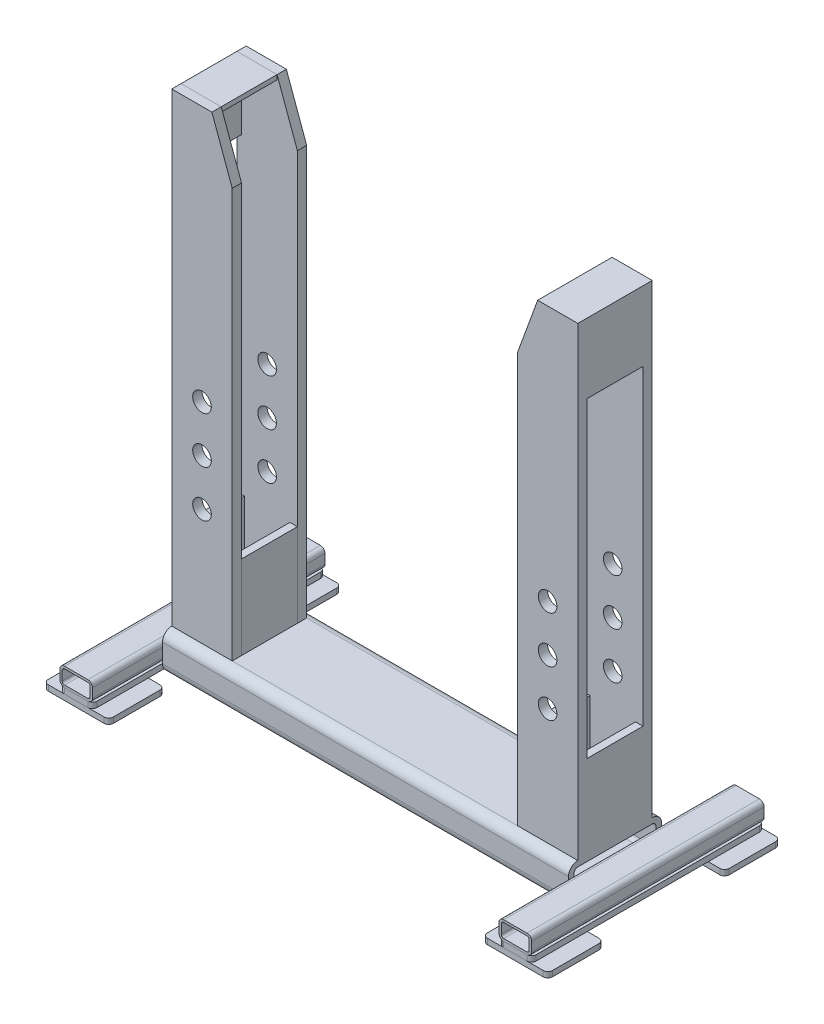
from build123d import *

# Parameters (mm, degrees)
BOSS_EXTRUDE1_DEPTH                    = 12
BOSS_EXTRUDE1_2_DEPTH                  = 12
RECTANGULAR_TUBE_70_X_40_X_5_1_DEPTH   = 500
RECTANGULAR_TUBE_70_X_40_X_5_1_2_DEPTH = 500
RECTANGULAR_TUBE_120_X_80_X_8_1_DEPTH  = 873
BOSS_EXTRUDE2_DEPTH                    = 12
BOSS_EXTRUDE2_2_DEPTH                  = 12
BOSS_EXTRUDE2_3_DEPTH                  = 12
BOSS_EXTRUDE2_4_DEPTH                  = 12
SKETCH18_W                             = 130
SKETCH18_H                             = 20
BOSS_EXTRUDE3_DEPTH                    = 1000
BOSS_EXTRUDE3_2_DEPTH                  = 1000
SKETCH19_W                             = 16
SKETCH19_H                             = 180
BOSS_EXTRUDE4_DEPTH                    = 120
BOSS_EXTRUDE4_2_DEPTH                  = 120
CUT_EXTRUDE1_DEPTH                     = 1200
SKETCH21_R                             = 20
CUT_EXTRUDE2_DEPTH                     = 1200
LPATTERN1_COUNT                        = 3
LPATTERN1_PITCH                        = 100
MIRROR2_COPY_1_SKETCH_R                = 20
MIRROR2_COPY_1_DEPTH                   = 1200
MIRROR2_COPY_2_SKETCH_R                = 20
MIRROR2_COPY_2_DEPTH                   = 1200
BOSS_EXTRUDE5_DEPTH                    = 120


with BuildPart() as part:
    # Sketch1 → Boss-Extrude1 (new body)
    with BuildSketch(Plane(origin=(0, 0, 0), x_dir=(1, 0, 0), z_dir=(0, 1, 0))):
        with BuildLine():
            Line((-497, -250), (-447, -250))
            ThreePointArc((-447, -250), (-439.928932188, -247.071067812), (-437, -240))
            Line((-437, -240), (-437, 240))
            ThreePointArc((-437, 240), (-439.928932188, 247.071067812), (-447, 250))
            Line((-447, 250), (-497, 250))
            ThreePointArc((-497, 250), (-504.071067812, 247.071067812), (-507, 240))
            Line((-507, 240), (-507, -240))
            ThreePointArc((-507, -240), (-504.071067812, -247.071067812), (-497, -250))
        make_face()
    extrude(amount=BOSS_EXTRUDE1_DEPTH)


with BuildPart() as body_2:
    # Sketch1 → Boss-Extrude1 2 (new body)
    with BuildSketch(Plane(origin=(0, 0, 0), x_dir=(1, 0, 0), z_dir=(0, 1, 0))):
        with BuildLine():
            Line((447, -250), (497, -250))
            ThreePointArc((497, -250), (504.071067812, -247.071067812), (507, -240))
            Line((507, -240), (507, 240))
            ThreePointArc((507, 240), (504.071067812, 247.071067812), (497, 250))
            Line((497, 250), (447, 250))
            ThreePointArc((447, 250), (439.928932188, 247.071067812), (437, 240))
            Line((437, 240), (437, -240))
            ThreePointArc((437, -240), (439.928932188, -247.071067812), (447, -250))
        make_face()
    extrude(amount=BOSS_EXTRUDE1_2_DEPTH)


with BuildPart() as body_3:
    # Sketch11 → Rectangular tube 70 X 40 X 5(1) (new body)
    with BuildSketch(Plane(origin=(472, 32, 250), x_dir=(0, 1, 0), z_dir=(0, 0, -1))):
        with BuildLine():
            Line((-10, -35), (10, -35))
            ThreePointArc((10, -35), (17.071067812, -32.071067812), (20, -25))
            Line((20, -25), (20, 25))
            ThreePointArc((20, 25), (17.071067812, 32.071067812), (10, 35))
            Line((10, 35), (-10, 35))
            ThreePointArc((-10, 35), (-17.071067812, 32.071067812), (-20, 25))
            Line((-20, 25), (-20, -25))
            ThreePointArc((-20, -25), (-17.071067812, -32.071067812), (-10, -35))
        make_face()
        with BuildLine():
            Line((-10, -30), (10, -30))
            ThreePointArc((10, -30), (13.535533906, -28.535533906), (15, -25))
            Line((15, -25), (15, 25))
            ThreePointArc((15, 25), (13.535533906, 28.535533906), (10, 30))
            Line((10, 30), (-10, 30))
            ThreePointArc((-10, 30), (-13.535533906, 28.535533906), (-15, 25))
            Line((-15, 25), (-15, -25))
            ThreePointArc((-15, -25), (-13.535533906, -28.535533906), (-10, -30))
        make_face(mode=Mode.SUBTRACT)
    extrude(amount=RECTANGULAR_TUBE_70_X_40_X_5_1_DEPTH)


with BuildPart() as body_4:
    # Sketch11 on segment 2 (carried to segment 2) → Rectangular tube 70 X 40 X 5_1 2 (new body)
    with BuildSketch(Plane(origin=(-472, 32, 250), x_dir=(0, 1, 0), z_dir=(0, 0, -1))):
        with BuildLine():
            Line((-10, -35), (10, -35))
            ThreePointArc((10, -35), (17.071067812, -32.071067812), (20, -25))
            Line((20, -25), (20, 25))
            ThreePointArc((20, 25), (17.071067812, 32.071067812), (10, 35))
            Line((10, 35), (-10, 35))
            ThreePointArc((-10, 35), (-17.071067812, 32.071067812), (-20, 25))
            Line((-20, 25), (-20, -25))
            ThreePointArc((-20, -25), (-17.071067812, -32.071067812), (-10, -35))
        make_face()
        with BuildLine():
            Line((-10, -30), (10, -30))
            ThreePointArc((10, -30), (13.535533906, -28.535533906), (15, -25))
            Line((15, -25), (15, 25))
            ThreePointArc((15, 25), (13.535533906, 28.535533906), (10, 30))
            Line((10, 30), (-10, 30))
            ThreePointArc((-10, 30), (-13.535533906, 28.535533906), (-15, 25))
            Line((-15, 25), (-15, -25))
            ThreePointArc((-15, -25), (-13.535533906, -28.535533906), (-10, -30))
        make_face(mode=Mode.SUBTRACT)
    extrude(amount=RECTANGULAR_TUBE_70_X_40_X_5_1_2_DEPTH)


with BuildPart() as body_5:
    # Sketch12 → Rectangular tube 120 X 80 X 8(1) (new body)
    with BuildSketch(Plane(origin=(-436.5, 32, 0), x_dir=(0, 1, 0), z_dir=(1, 0, 0))):
        with BuildLine():
            Line((-20, -100), (20, -100))
            ThreePointArc((20, -100), (34.142135624, -94.142135624), (40, -80))
            Line((40, -80), (40, 80))
            ThreePointArc((40, 80), (34.142135624, 94.142135624), (20, 100))
            Line((20, 100), (-20, 100))
            ThreePointArc((-20, 100), (-34.142135624, 94.142135624), (-40, 80))
            Line((-40, 80), (-40, -80))
            ThreePointArc((-40, -80), (-34.142135624, -94.142135624), (-20, -100))
        make_face()
        with BuildLine():
            Line((-20, -88), (20, -88))
            ThreePointArc((20, -88), (25.656854249, -85.656854249), (28, -80))
            Line((28, -80), (28, 80))
            ThreePointArc((28, 80), (25.656854249, 85.656854249), (20, 88))
            Line((20, 88), (-20, 88))
            ThreePointArc((-20, 88), (-25.656854249, 85.656854249), (-28, 80))
            Line((-28, 80), (-28, -80))
            ThreePointArc((-28, -80), (-25.656854249, -85.656854249), (-20, -88))
        make_face(mode=Mode.SUBTRACT)
    extrude(amount=RECTANGULAR_TUBE_120_X_80_X_8_1_DEPTH)


with BuildPart() as body_6:
    # Sketch17 → Boss-Extrude2 (new body)
    with BuildSketch(Plane.XZ):
        with BuildLine():
            Line((412, 250), (532, 250))
            ThreePointArc((532, 250), (539.071067812, 247.071067812), (542, 240))
            Line((542, 240), (542, 140))
            ThreePointArc((542, 140), (539.071067812, 132.928932188), (532, 130))
            Line((532, 130), (412, 130))
            ThreePointArc((412, 130), (404.928932188, 132.928932188), (402, 140))
            Line((402, 140), (402, 240))
            ThreePointArc((402, 240), (404.928932188, 247.071067812), (412, 250))
        make_face()
    extrude(amount=BOSS_EXTRUDE2_DEPTH)


with BuildPart() as body_7:
    # Sketch17 → Boss-Extrude2 2 (new body)
    with BuildSketch(Plane.XZ):
        with BuildLine():
            Line((-542, 240), (-542, 140))
            ThreePointArc((-542, 140), (-539.071067812, 132.928932188), (-532, 130))
            Line((-532, 130), (-412, 130))
            ThreePointArc((-412, 130), (-404.928932188, 132.928932188), (-402, 140))
            Line((-402, 140), (-402, 240))
            ThreePointArc((-402, 240), (-404.928932188, 247.071067812), (-412, 250))
            Line((-412, 250), (-532, 250))
            ThreePointArc((-532, 250), (-539.071067812, 247.071067812), (-542, 240))
        make_face()
    extrude(amount=BOSS_EXTRUDE2_2_DEPTH)


with BuildPart() as body_8:
    # Sketch17 → Boss-Extrude2 3 (new body)
    with BuildSketch(Plane.XZ):
        with BuildLine():
            Line((542, -240), (542, -140))
            ThreePointArc((542, -140), (539.071067812, -132.928932188), (532, -130))
            Line((532, -130), (412, -130))
            ThreePointArc((412, -130), (404.928932188, -132.928932188), (402, -140))
            Line((402, -140), (402, -240))
            ThreePointArc((402, -240), (404.928932188, -247.071067812), (412, -250))
            Line((412, -250), (532, -250))
            ThreePointArc((532, -250), (539.071067812, -247.071067812), (542, -240))
        make_face()
    extrude(amount=BOSS_EXTRUDE2_3_DEPTH)


with BuildPart() as body_9:
    # Sketch17 → Boss-Extrude2 4 (new body)
    with BuildSketch(Plane.XZ):
        with BuildLine():
            Line((-412, -250), (-532, -250))
            ThreePointArc((-532, -250), (-539.071067812, -247.071067812), (-542, -240))
            Line((-542, -240), (-542, -140))
            ThreePointArc((-542, -140), (-539.071067812, -132.928932188), (-532, -130))
            Line((-532, -130), (-412, -130))
            ThreePointArc((-412, -130), (-404.928932188, -132.928932188), (-402, -140))
            Line((-402, -140), (-402, -240))
            ThreePointArc((-402, -240), (-404.928932188, -247.071067812), (-412, -250))
        make_face()
    extrude(amount=BOSS_EXTRUDE2_4_DEPTH)


with BuildPart() as body_10:
    # Sketch18 → Boss-Extrude3 (new body)
    with BuildSketch(Plane(origin=(0, 72, 0), x_dir=(1, 0, 0), z_dir=(0, 1, 0))):
        with Locations((-371.5, -70)):
            Rectangle(SKETCH18_W, SKETCH18_H)
    boss_extrude3 = extrude(amount=BOSS_EXTRUDE3_DEPTH)


with BuildPart() as body_11:
    # Sketch18 → Boss-Extrude3 2 (new body)
    with BuildSketch(Plane(origin=(0, 72, 0), x_dir=(1, 0, 0), z_dir=(0, 1, 0))):
        with Locations((-371.5, 70)):
            Rectangle(SKETCH18_W, SKETCH18_H)
    boss_extrude3_2 = extrude(amount=BOSS_EXTRUDE3_2_DEPTH)


with BuildPart() as body_12:
    # Sketch19 → Boss-Extrude4 (new body)
    with BuildSketch(Plane.XY.offset(-60)):
        with Locations((-428.5, 162)):
            Rectangle(SKETCH19_W, SKETCH19_H)
    boss_extrude4 = extrude(amount=BOSS_EXTRUDE4_DEPTH)


with BuildPart() as body_13:
    # Sketch19 → Boss-Extrude4 2 (new body)
    with BuildSketch(Plane.XY.offset(-60)):
        with Locations((-314.5, 162)):
            Rectangle(SKETCH19_W, SKETCH19_H)
    boss_extrude4_2 = extrude(amount=BOSS_EXTRUDE4_2_DEPTH)


with BuildPart() as body_5_1:
    add(body_5.part)

    # Mirror1: Boss-Extrude3, Boss-Extrude3 2, Boss-Extrude4, Boss-Extrude4 2 across plane
    add(boss_extrude3.mirror(Plane(origin=(0, 0, 0), x_dir=(0, 0, 1), z_dir=(1, 0, 0))))
    add(boss_extrude3_2.mirror(Plane(origin=(0, 0, 0), x_dir=(0, 0, 1), z_dir=(1, 0, 0))))
    add(boss_extrude4.mirror(Plane(origin=(0, 0, 0), x_dir=(0, 0, 1), z_dir=(1, 0, 0))))
    add(boss_extrude4_2.mirror(Plane(origin=(0, 0, 0), x_dir=(0, 0, 1), z_dir=(1, 0, 0))))


with BuildPart() as cut_extrude1_tool:
    # Sketch20 → Cut-Extrude1 (new body)
    with BuildSketch(Plane.XY.offset(80)):
        Polygon((-306.5, 1072), (-350.176428112, 1072), (-306.5, 952), align=None)
        Polygon((306.5, 1072), (306.5, 952), (350.176428112, 1072), align=None)
    extrude(amount=-CUT_EXTRUDE1_DEPTH)


with BuildPart() as body_5_2:
    add(body_5_1.part)

    # Cut-Extrude1: cut by cut_extrude1_tool
    add(cut_extrude1_tool.part, mode=Mode.SUBTRACT)


with BuildPart() as body_10_1:
    add(body_10.part)

    # Cut-Extrude1: cut by cut_extrude1_tool
    add(cut_extrude1_tool.part, mode=Mode.SUBTRACT)


with BuildPart() as body_11_1:
    add(body_11.part)

    # Cut-Extrude1: cut by cut_extrude1_tool
    add(cut_extrude1_tool.part, mode=Mode.SUBTRACT)


with BuildPart() as cut_extrude2_tool:
    # Sketch21 → Cut-Extrude2 (new body)
    with BuildSketch(Plane.XY.offset(80)):
        with Locations((-371.5, 322)):
            Circle(SKETCH21_R)
    cut_extrude2 = extrude(amount=-CUT_EXTRUDE2_DEPTH)


with BuildPart() as body_10_2:
    add(body_10_1.part)

    # Cut-Extrude2: cut by cut_extrude2_tool
    add(cut_extrude2_tool.part, mode=Mode.SUBTRACT)


with BuildPart() as body_11_2:
    add(body_11_1.part)

    # Cut-Extrude2: cut by cut_extrude2_tool
    add(cut_extrude2_tool.part, mode=Mode.SUBTRACT)


with BuildPart() as lpattern1_tool:
    # LPattern1: Cut-Extrude2 ×3
    with Locations(*[(0, i * LPATTERN1_PITCH, 0) for i in range(1, LPATTERN1_COUNT)]):
        add(cut_extrude2)


with BuildPart() as body_10_3:
    add(body_10_2.part)

    # LPattern1: cut by lpattern1_tool
    add(lpattern1_tool.part, mode=Mode.SUBTRACT)


with BuildPart() as body_11_3:
    add(body_11_2.part)

    # LPattern1: cut by lpattern1_tool
    add(lpattern1_tool.part, mode=Mode.SUBTRACT)


with BuildPart() as body_5_3:
    add(body_5_2.part)

    # Mirror2: Cut-Extrude2 across plane
    add(cut_extrude2.mirror(Plane(origin=(0, 0, 0), x_dir=(0, 0, 1), z_dir=(1, 0, 0))), mode=Mode.SUBTRACT)

    # Mirror2 copy 1 sketch → Mirror2 copy 1 (cut)
    with BuildSketch(Plane(origin=(0, 100, 80), x_dir=(-1, 0, 0), z_dir=(0, 0, 1))):
        with Locations((-371.5, -322)):
            Circle(MIRROR2_COPY_1_SKETCH_R)
    extrude(amount=-MIRROR2_COPY_1_DEPTH, mode=Mode.SUBTRACT)

    # Mirror2 copy 2 sketch → Mirror2 copy 2 (cut)
    with BuildSketch(Plane(origin=(0, 200, 80), x_dir=(-1, 0, 0), z_dir=(0, 0, 1))):
        with Locations((-371.5, -322)):
            Circle(MIRROR2_COPY_2_SKETCH_R)
    extrude(amount=-MIRROR2_COPY_2_DEPTH, mode=Mode.SUBTRACT)


with BuildPart() as body_14:
    # Sketch22 → Boss-Extrude5 (new body)
    with BuildSketch(Plane.XY.offset(-60)):
        Polygon((-436.5, 1072), (-350.176428112, 1072), (-350.176428112, 1062), (-426.5, 1062), (-426.5, 922), (-436.5, 922), align=None)
    boss_extrude5 = extrude(amount=BOSS_EXTRUDE5_DEPTH)


with BuildPart() as body_5_4:
    add(body_5_3.part)

    # Mirror5: Boss-Extrude5 across plane
    add(boss_extrude5.mirror(Plane(origin=(0, 0, 0), x_dir=(0, 0, 1), z_dir=(1, 0, 0))))


solid = Compound([part.part, body_2.part, body_3.part, body_4.part, body_6.part, body_7.part, body_8.part, body_9.part, body_12.part, body_13.part, body_10_3.part, body_11_3.part, body_14.part, body_5_4.part])
